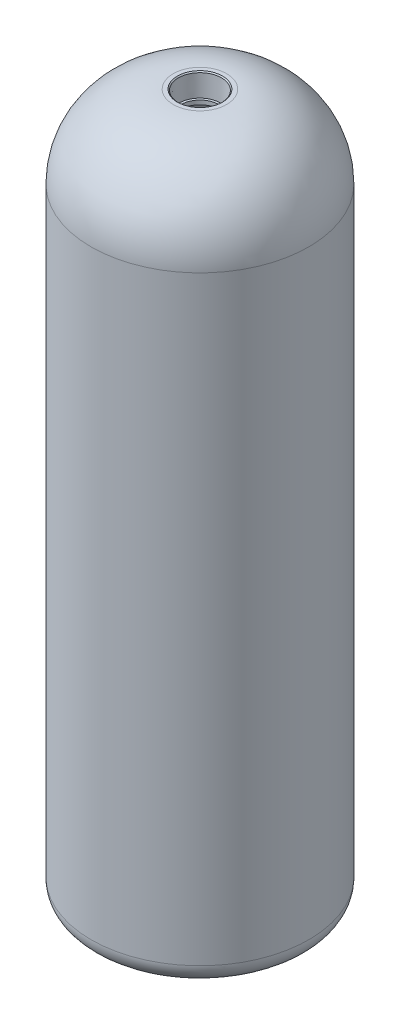
from build123d import *


with BuildPart() as part:
    # Sketch4 → Revolve1 (revolve)
    with BuildSketch(Plane(origin=(0, 0, 0), x_dir=(0, 0, -1), z_dir=(1, 0, 0))):
        with BuildLine():
            Line((-54.61, 0), (0, 0))
            Line((0, 0), (0, 16.51))
            Line((0, 16.51), (-38.1, 16.51))
            ThreePointArc((-38.1, 16.51), (-47.080256121, 20.229743879), (-50.8, 29.21))
            Line((-50.8, 29.21), (-50.8, 379.73))
            ThreePointArc((-50.8, 379.73), (-39.640768363, 406.670768363), (-12.7, 417.83))
            Line((-12.7, 417.83), (0, 417.83))
            Line((0, 417.83), (0, 434.34))
            Line((0, 434.34), (-16.51, 434.34))
            ThreePointArc((-16.51, 434.34), (-52.431024484, 419.461024484), (-67.31, 383.54))
            Line((-67.31, 383.54), (-67.31, 12.7))
            ThreePointArc((-67.31, 12.7), (-63.590256121, 3.719743879), (-54.61, 0))
        make_face()
    revolve(axis=Axis((0, 434.34, 0), (0, -1, 0)))

    # Sketch6 → 3/4 NPT Tapped Hole2 (revolve, cut)
    with BuildSketch(Plane(origin=(0, 434.34, 0), x_dir=(0, 0, 1), z_dir=(1, 0, 0))):
        Polygon((0, 0), (0, 30.027622455), (11.5062, 23.114), (11.5062, 13.97), (12.933217642, 13.97), (13.3324854, 0.635), (13.9674854, 0), align=None)
    revolve(axis=Axis((0, 440.69, 0), (0, -1, 0)), mode=Mode.SUBTRACT)


solid = part.part
